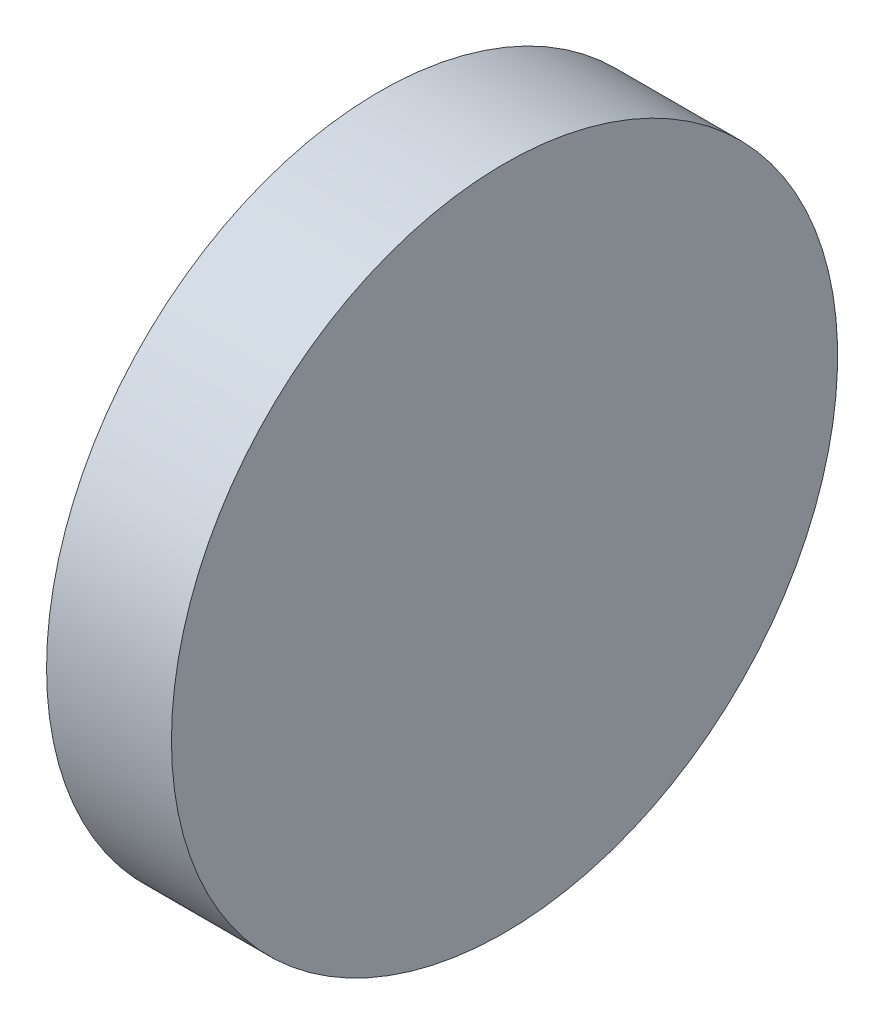
from build123d import *

# Parameters (mm, degrees)
SKETCH1_R           = 12.7
BOSS_EXTRUDE1_DEPTH = 4.7625


with BuildPart() as part:
    # Sketch1 → Boss-Extrude1 (new body)
    with BuildSketch(Plane(origin=(0, 0, 0), x_dir=(0, 0, -1), z_dir=(1, 0, 0))):
        with Locations(Location((0, 0, 0), (0, 0, 180))):
            Circle(SKETCH1_R)
    extrude(amount=BOSS_EXTRUDE1_DEPTH)


solid = part.part
